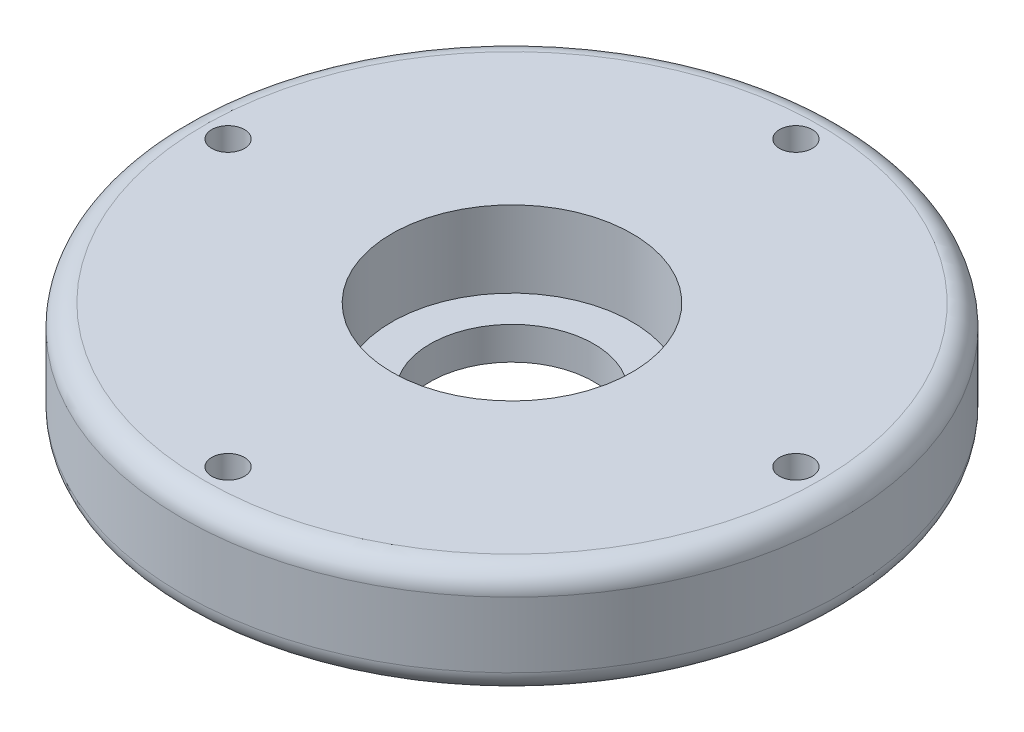
from build123d import *

# Parameters (mm, degrees)
SKETCH1_R           = 30.18
SKETCH1_R_2         = 7.5
BOSS_EXTRUDE1_DEPTH = 10
SKETCH2_R           = 1.5
CUT_EXTRUDE1_DEPTH  = 44.836797328
SKETCH3_R           = 11
CUT_EXTRUDE2_DEPTH  = 7
FILLET1_R           = 2


with BuildPart() as part:
    # Sketch1 → Boss-Extrude1 (new body)
    with BuildSketch(Plane(origin=(0, 0, 0), x_dir=(1, 0, 0), z_dir=(0, 1, 0))):
        with Locations(Location((0, 0, 0), (0, 0, 270))):
            Circle(SKETCH1_R)
        with Locations(Location((0, 0, 0), (0, 0, 270))):
            Circle(SKETCH1_R_2, mode=Mode.SUBTRACT)
    extrude(amount=BOSS_EXTRUDE1_DEPTH)

    # Sketch2 → Cut-Extrude1 (cut, through all)
    with BuildSketch(Plane(origin=(0, 10, 0), x_dir=(1, 0, 0), z_dir=(0, 1, 0))):
        with Locations(Location((0, 26, 0), (0, 0, 270))):
            Circle(SKETCH2_R)
        with Locations(Location((26, 0, 0), (0, 0, 270))):
            Circle(SKETCH2_R)
        with Locations(Location((-26, 0, 0), (0, 0, 270))):
            Circle(SKETCH2_R)
        with Locations(Location((0, -26, 0), (0, 0, 270))):
            Circle(SKETCH2_R)
    extrude(amount=-CUT_EXTRUDE1_DEPTH, mode=Mode.SUBTRACT)

    # Sketch3 → Cut-Extrude2 (cut)
    with BuildSketch(Plane(origin=(0, 10, 0), x_dir=(1, 0, 0), z_dir=(0, 1, 0))):
        with Locations(Location((0, 0, 0), (0, 0, 270))):
            Circle(SKETCH3_R)
    extrude(amount=-CUT_EXTRUDE2_DEPTH, mode=Mode.SUBTRACT)

    # Fillet1
    fillet1_edges = [part.edges().sort_by_distance(p)[0] for p in [
        (0, 0, -30.18),
        (0, 10, -30.18),
    ]]
    fillet(fillet1_edges, radius=FILLET1_R)


solid = part.part
